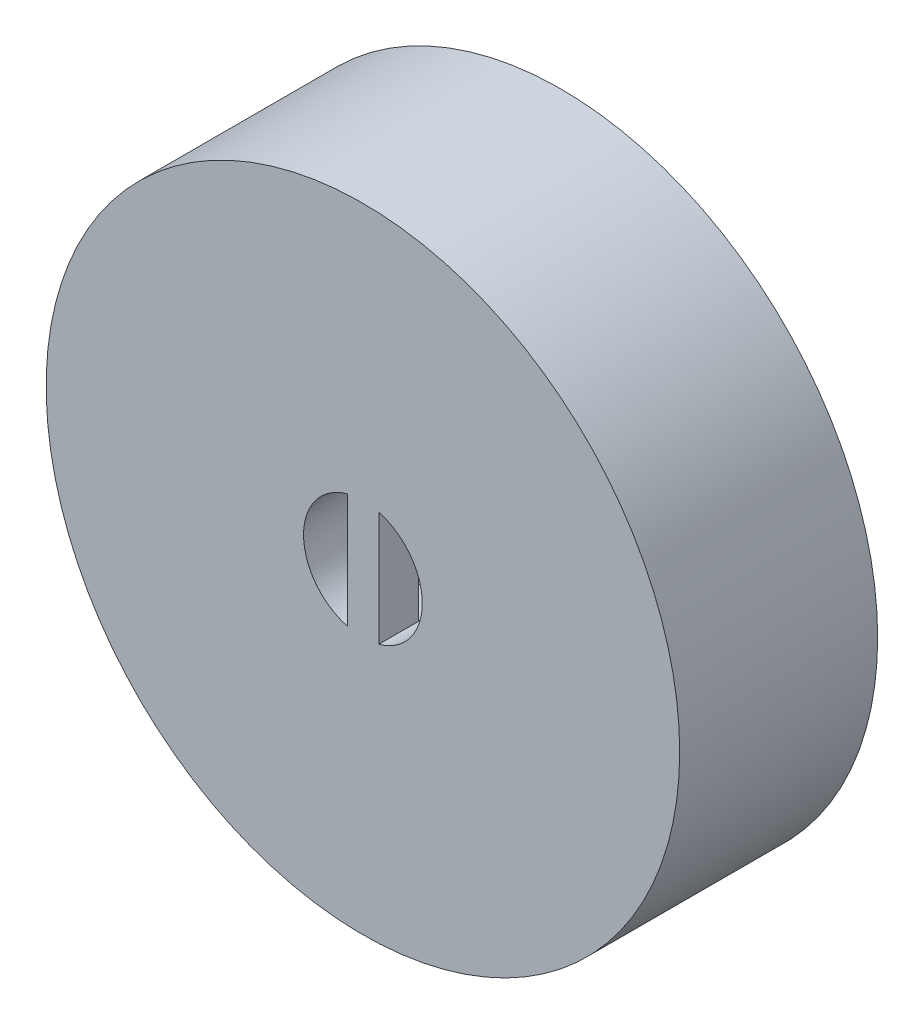
from build123d import *

# Parameters (mm, degrees)
SKETCH1_R               = 25.4
BOSS_EXTRUDE1_DEPTH     = 15.875
SKETCH6_R               = 9.525
BOSS_EXTRUDE3_DEPTH     = 9.525
CUT_EXTRUDE3_DEPTH      = 49.09113031
CUT_EXTRUDE3_DEPTH_BACK = 49.09113031
CUT_EXTRUDE5_DEPTH      = 22.225


with BuildPart() as part:
    # Sketch1 → Boss-Extrude1 (new body)
    with BuildSketch(Plane.XY):
        with Locations((-6.575565897, 0)):
            Circle(SKETCH1_R)
    extrude(amount=BOSS_EXTRUDE1_DEPTH)

    # Sketch6 → Boss-Extrude3 (add)
    with BuildSketch(Plane(origin=(0, 0, 0), x_dir=(-1, 0, 0), z_dir=(0, 0, -1))):
        with Locations(Location((6.575565897, 0, 0), (0, 0, 180))):
            Circle(SKETCH6_R)
    extrude(amount=BOSS_EXTRUDE3_DEPTH)

    # Sketch2 → Cut-Extrude3 (cut, two sides: drawn at the far end of the back side and taken through both)
    with BuildSketch(Plane.XY.offset(15.875).offset(-CUT_EXTRUDE3_DEPTH_BACK)):
        with BuildLine():
            Line((-7.824241479, 4.595891159), (-7.824241479, -4.595891159))
            ThreePointArc((-7.824241479, -4.595891159), (-11.338065897, 0), (-7.824241479, 4.595891159))
        make_face()
        with BuildLine():
            Line((-5.305565897, 4.590044254), (-5.305565897, -4.590044254))
            ThreePointArc((-5.305565897, -4.590044254), (-1.813065897, 0), (-5.305565897, 4.590044254))
        make_face()
    extrude(amount=CUT_EXTRUDE3_DEPTH + CUT_EXTRUDE3_DEPTH_BACK, mode=Mode.SUBTRACT)

    # Sketch10 → Cut-Extrude5 (cut)
    with BuildSketch(Plane(origin=(0, 0, -9.525), x_dir=(-1, 0, 0), z_dir=(0, 0, -1))):
        Polygon((5.305565897, 4.590044254), (5.305565897, -4.590044254), (7.824241479, -4.595891159), (7.824241479, 4.595891159), align=None)
    extrude(amount=-CUT_EXTRUDE5_DEPTH, mode=Mode.SUBTRACT)


solid = part.part
